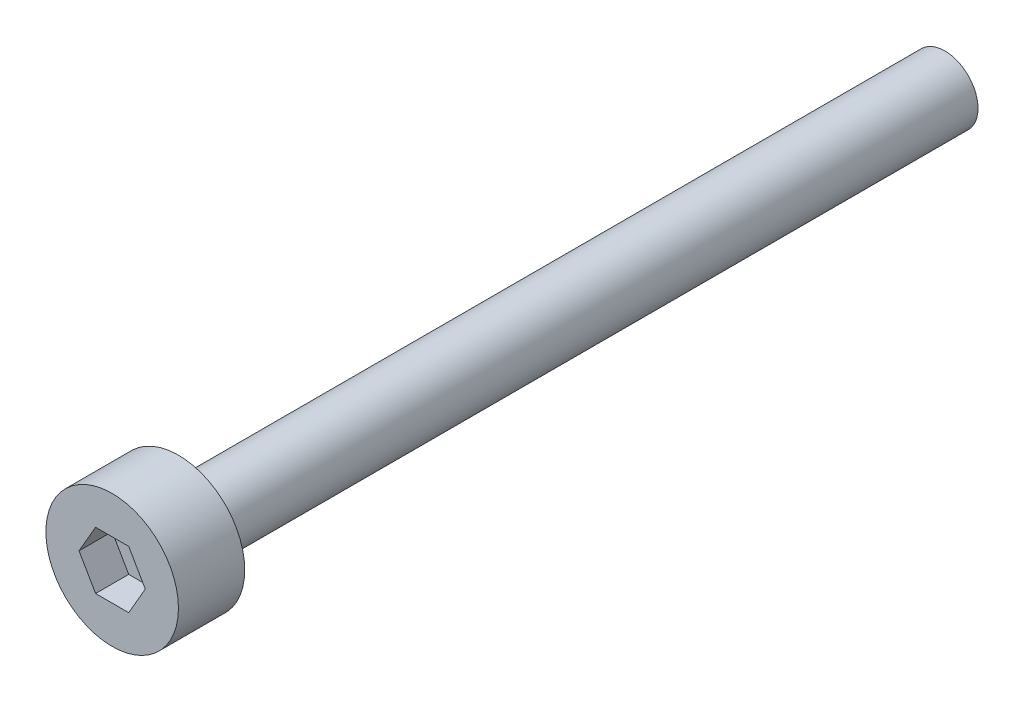
from build123d import *

# Parameters (mm, degrees)
SKETCH_1_R          = 1.6
EXTRUDE_1_DEPTH     = 1.6
SKETCH_3_R          = 0.8
EXTRUDE_2_DEPTH     = 18.5
CUT_EXTRUDE_1_DEPTH = 0.8


with BuildPart() as part:
    # 草图1 → 凸台-拉伸1 (new body)
    with BuildSketch(Plane.XY):
        Circle(SKETCH_1_R)
    extrude(amount=EXTRUDE_1_DEPTH)

    # 草图3 → 凸台-拉伸2 (add)
    with BuildSketch(Plane.XY):
        Circle(SKETCH_3_R)
    extrude(amount=-EXTRUDE_2_DEPTH)

    # 草图4 → 切除-拉伸1 (cut)
    with BuildSketch(Plane.XY.offset(1.6)):
        Polygon((0.8, 0), (0.4, 0.692820323), (-0.4, 0.692820323), (-0.8, 0), (-0.4, -0.692820323), (0.4, -0.692820323), align=None)
    extrude(amount=-CUT_EXTRUDE_1_DEPTH, mode=Mode.SUBTRACT)


solid = part.part
